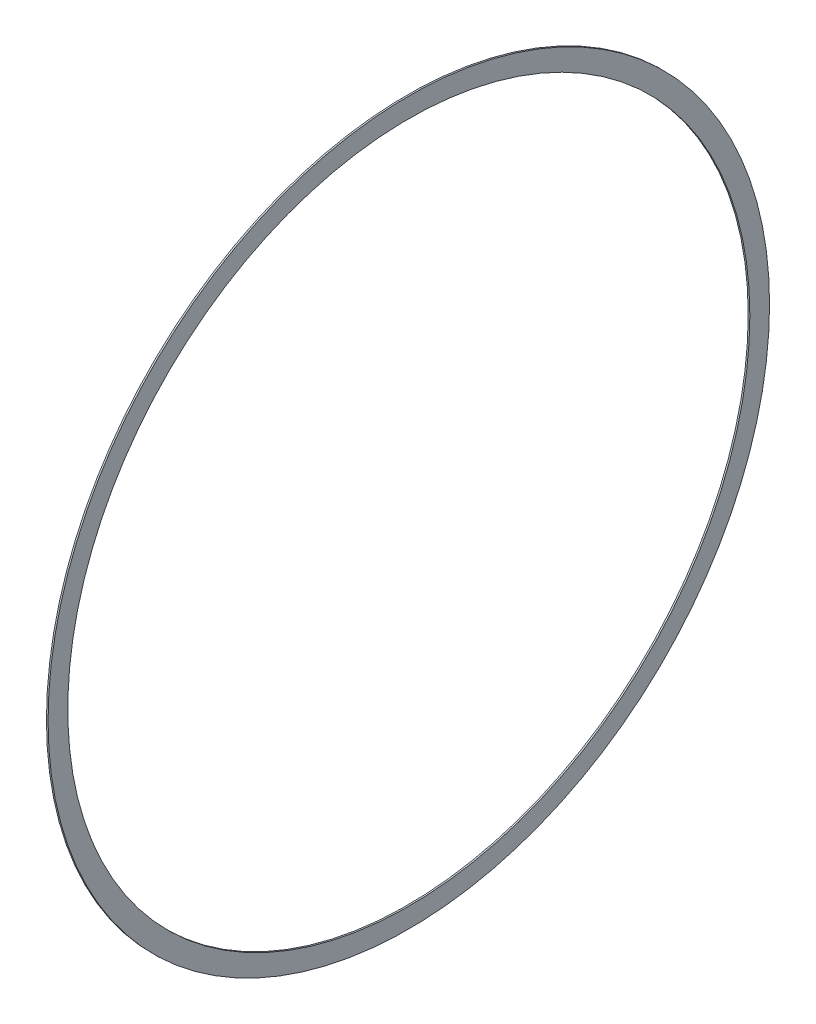
from build123d import *

# Parameters (mm, degrees)
SKETCH1_R           = 1116
SKETCH1_R_2         = 1055
BOSS_EXTRUDE1_DEPTH = 5


with BuildPart() as part:
    # Sketch1 → Boss-Extrude1 (new body)
    with BuildSketch(Plane(origin=(0, 0, 0), x_dir=(0, 0, -1), z_dir=(1, 0, 0))):
        Circle(SKETCH1_R)
        Circle(SKETCH1_R_2, mode=Mode.SUBTRACT)
    extrude(amount=BOSS_EXTRUDE1_DEPTH)


solid = part.part
